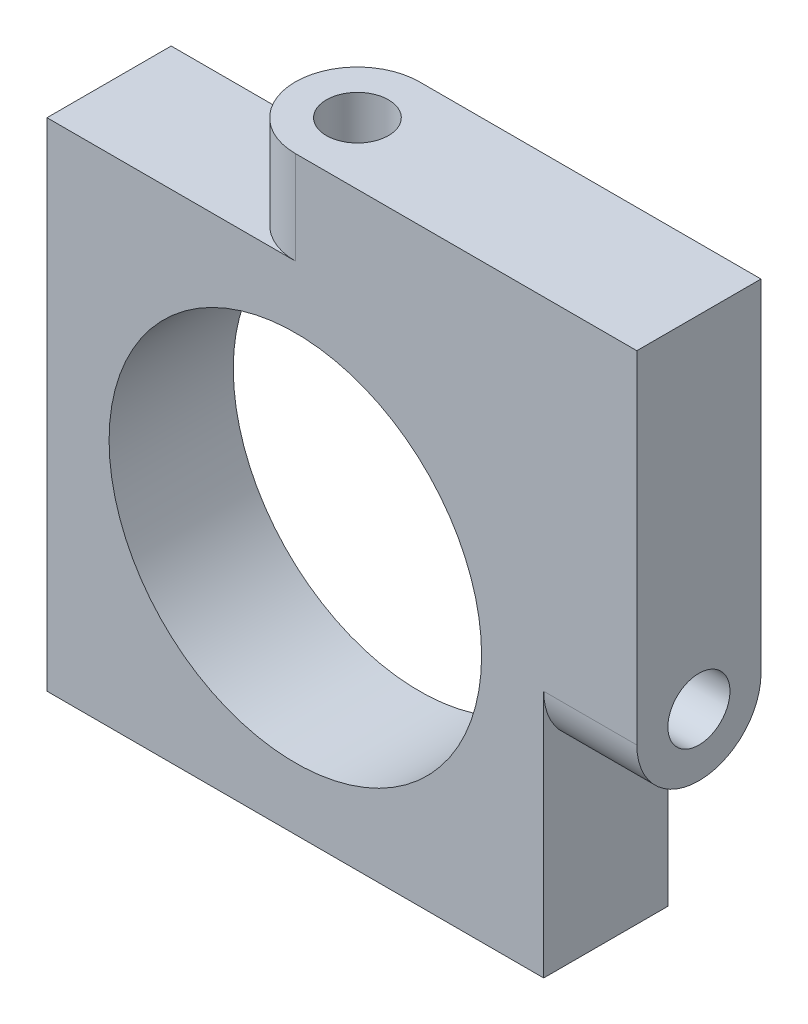
from build123d import *

# Parameters (mm, degrees)
SKETCH2_W           = 101.6
SKETCH2_H           = 101.6
SKETCH2_R           = 38.1
BOSS_EXTRUDE1_DEPTH = 25.4
SKETCH3_R           = 6.35
BOSS_EXTRUDE2_DEPTH = 19.05
SKETCH4_R           = 6.35
BOSS_EXTRUDE3_DEPTH = 19.05


with BuildPart() as part:
    # Sketch2 → Boss-Extrude1 (new body)
    with BuildSketch(Plane.XY):
        with Locations((50.8, 50.8)):
            Rectangle(SKETCH2_W, SKETCH2_H)
        with Locations((50.8, 50.8)):
            Circle(SKETCH2_R, mode=Mode.SUBTRACT)
    extrude(amount=BOSS_EXTRUDE1_DEPTH)

    # Sketch3 → Boss-Extrude2 (add)
    with BuildSketch(Plane(origin=(0, 101.6, 0), x_dir=(1, 0, 0), z_dir=(0, 1, 0))):
        with BuildLine():
            Line((101.6, -25.4), (101.6, 0))
            Line((101.6, 0), (50.8, 0))
            ThreePointArc((50.8, 0), (38.1, -12.7), (50.8, -25.4))
            Line((50.8, -25.4), (101.6, -25.4))
        make_face()
        with Locations(Location((50.8, -12.7, 0), (0, 0, 90))):
            Circle(SKETCH3_R, mode=Mode.SUBTRACT)
    extrude(amount=BOSS_EXTRUDE2_DEPTH)

    # Sketch4 → Boss-Extrude3 (add)
    with BuildSketch(Plane(origin=(101.6, 0, 0), x_dir=(0, 0, -1), z_dir=(1, 0, 0))):
        with BuildLine():
            Line((0, 120.65), (-25.4, 120.65))
            Line((-25.4, 120.65), (-25.4, 50.8))
            ThreePointArc((-25.4, 50.8), (-12.7, 38.1), (0, 50.8))
            Line((0, 50.8), (0, 120.65))
        make_face()
        with Locations(Location((-12.7, 50.8, 0), (0, 0, 180))):
            Circle(SKETCH4_R, mode=Mode.SUBTRACT)
    extrude(amount=BOSS_EXTRUDE3_DEPTH)


solid = part.part
